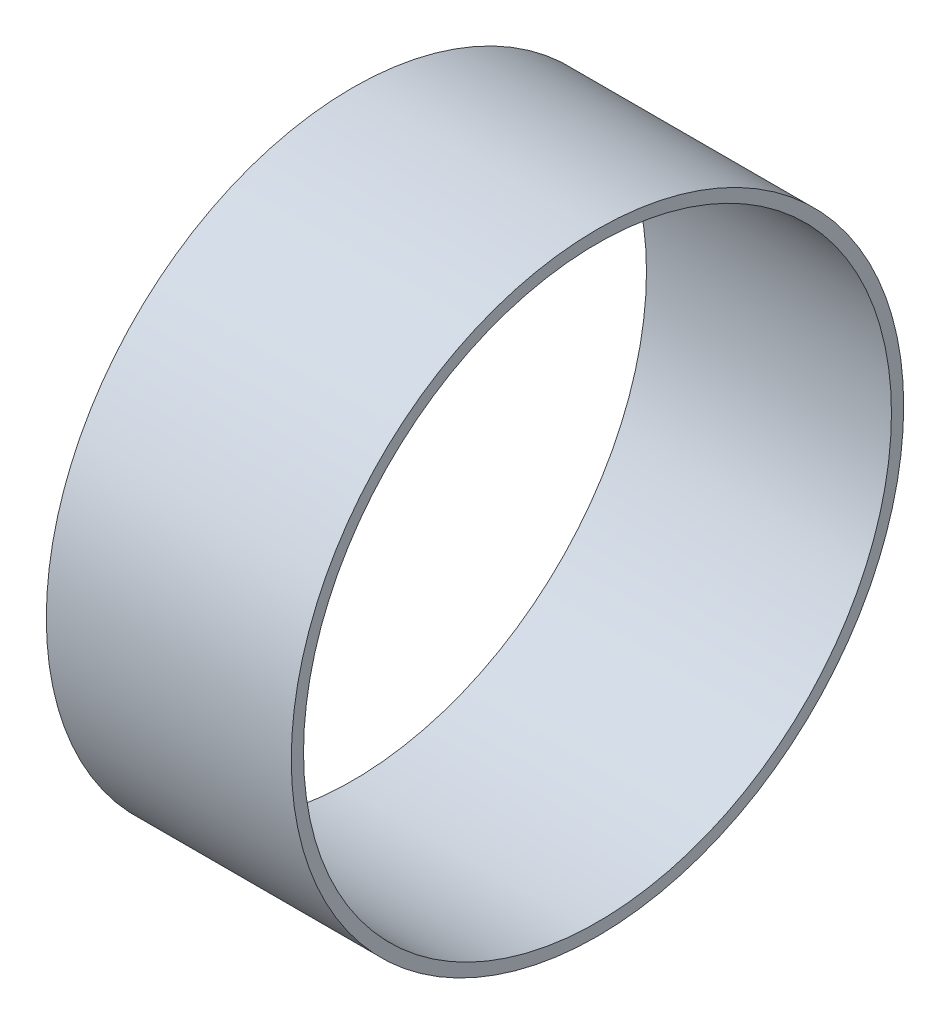
from build123d import *

# Parameters (mm, degrees)
ESBO_O1_R                = 12.5
ESBO_O1_R_2              = 12
RESSALTO_EXTRUS_O1_DEPTH = 10


with BuildPart() as part:
    # Esboço1 → Ressalto-extrusão1 (new body)
    with BuildSketch(Plane(origin=(0, 0, 0), x_dir=(0, 0, -1), z_dir=(1, 0, 0))):
        Circle(ESBO_O1_R)
        Circle(ESBO_O1_R_2, mode=Mode.SUBTRACT)
    extrude(amount=RESSALTO_EXTRUS_O1_DEPTH)


solid = part.part
